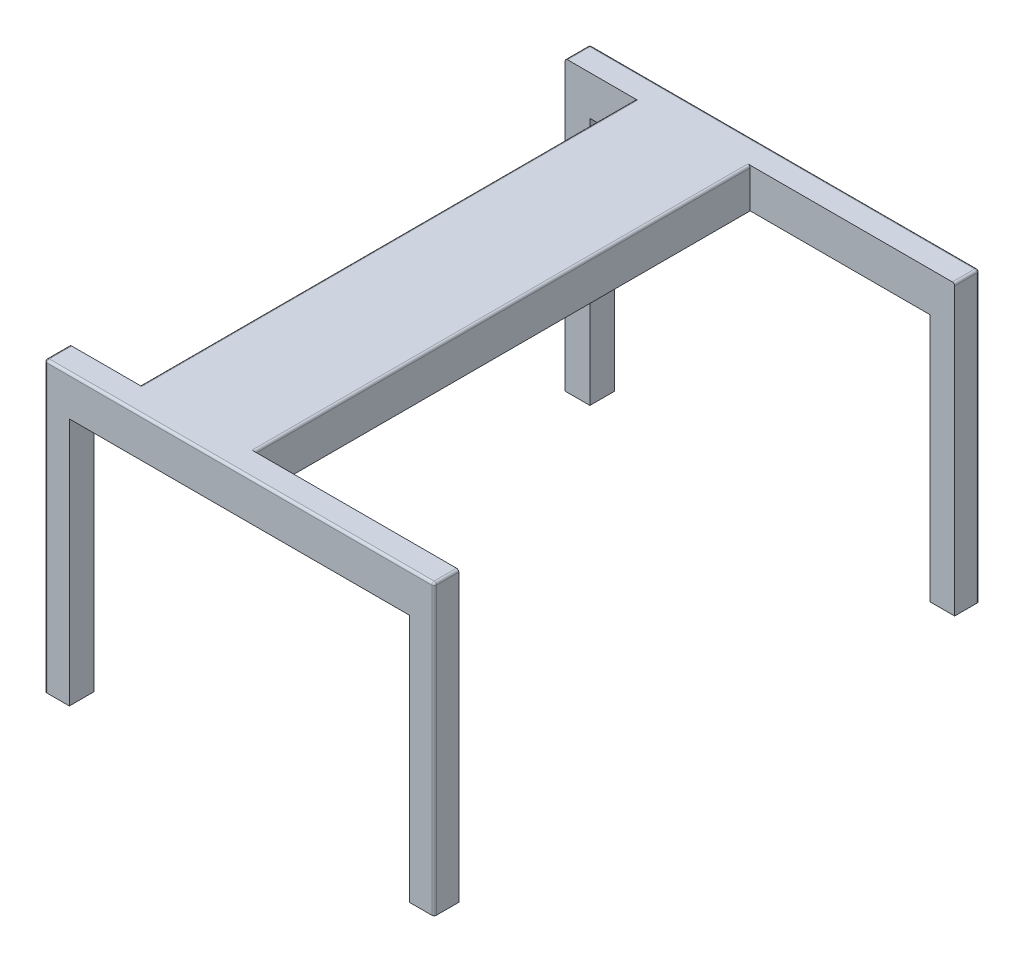
from build123d import *

# Parameters (mm, degrees)
CROQUIS1_W              = 1000
CROQUIS1_H              = 740
SALIENTE_EXTRUIR1_DEPTH = 1400
CROQUIS2_W              = 873
CROQUIS2_H              = 638.4
CORTAR_EXTRUIR1_DEPTH   = 1400
CROQUIS3_W              = 1273
CROQUIS3_H              = 638.4
CORTAR_EXTRUIR2_DEPTH   = 1000
CROQUIS4_W              = 180
CROQUIS4_H              = 1273
CROQUIS4_W_2            = 525
CORTAR_EXTRUIR3_DEPTH   = 200
REDONDEO1_R             = 6
REDONDEO2_R             = 6
REDONDEO4_R             = 6


with BuildPart() as part:
    # Croquis1 → Saliente-Extruir1 (new body)
    with BuildSketch(Plane.XY):
        with Locations((500, -370)):
            Rectangle(CROQUIS1_W, CROQUIS1_H)
    extrude(amount=SALIENTE_EXTRUIR1_DEPTH)

    # Croquis2 → Cortar-Extruir1 (cut)
    with BuildSketch(Plane.XY.offset(1400)):
        with Locations((500, -420.8)):
            Rectangle(CROQUIS2_W, CROQUIS2_H)
    extrude(amount=-CORTAR_EXTRUIR1_DEPTH, mode=Mode.SUBTRACT)

    # Croquis3 → Cortar-Extruir2 (cut)
    with BuildSketch(Plane(origin=(1000, 0, 0), x_dir=(0, 0, -1), z_dir=(1, 0, 0))):
        with Locations((-700, -420.8)):
            Rectangle(CROQUIS3_W, CROQUIS3_H)
    extrude(amount=-CORTAR_EXTRUIR2_DEPTH, mode=Mode.SUBTRACT)

    # Croquis4 → Cortar-Extruir3 (cut)
    with BuildSketch(Plane(origin=(0, 0, 0), x_dir=(1, 0, 0), z_dir=(0, 1, 0))):
        with Locations((90, -700)):
            Rectangle(CROQUIS4_W, CROQUIS4_H)
        with Locations((737.5, -700)):
            Rectangle(CROQUIS4_W_2, CROQUIS4_H)
    extrude(amount=-CORTAR_EXTRUIR3_DEPTH, mode=Mode.SUBTRACT)

    # Redondeo1
    redondeo1_edges = [part.edges().sort_by_distance(p)[0] for p in [
        (0, 0, 31.75),
        (0, 0, 1368.25),
        (1000, 0, 1368.25),
        (1000, 0, 31.75),
    ]]
    fillet(redondeo1_edges, radius=REDONDEO1_R)

    # Redondeo2
    redondeo2_edges = [part.edges().sort_by_distance(p)[0] for p in [
        (180, 0, 700),
        (475, 0, 700),
    ]]
    fillet(redondeo2_edges, radius=REDONDEO2_R)

    # Redondeo4
    redondeo4_edges = [part.edges().sort_by_distance(p)[0] for p in [
        (1000, -373, 1400),
        (0, -373, 1400),
        (500, 0, 0),
        (500, 0, 1400),
        (998.242640687, -1.757359313, 1400),
        (1.757359313, -1.757359313, 1400),
        (0, -373, 0),
        (998.242640687, -1.757359313, 0),
        (1.757359313, -1.757359313, 0),
        (1000, -373, 0),
    ]]
    fillet(redondeo4_edges, radius=REDONDEO4_R)


solid = part.part
